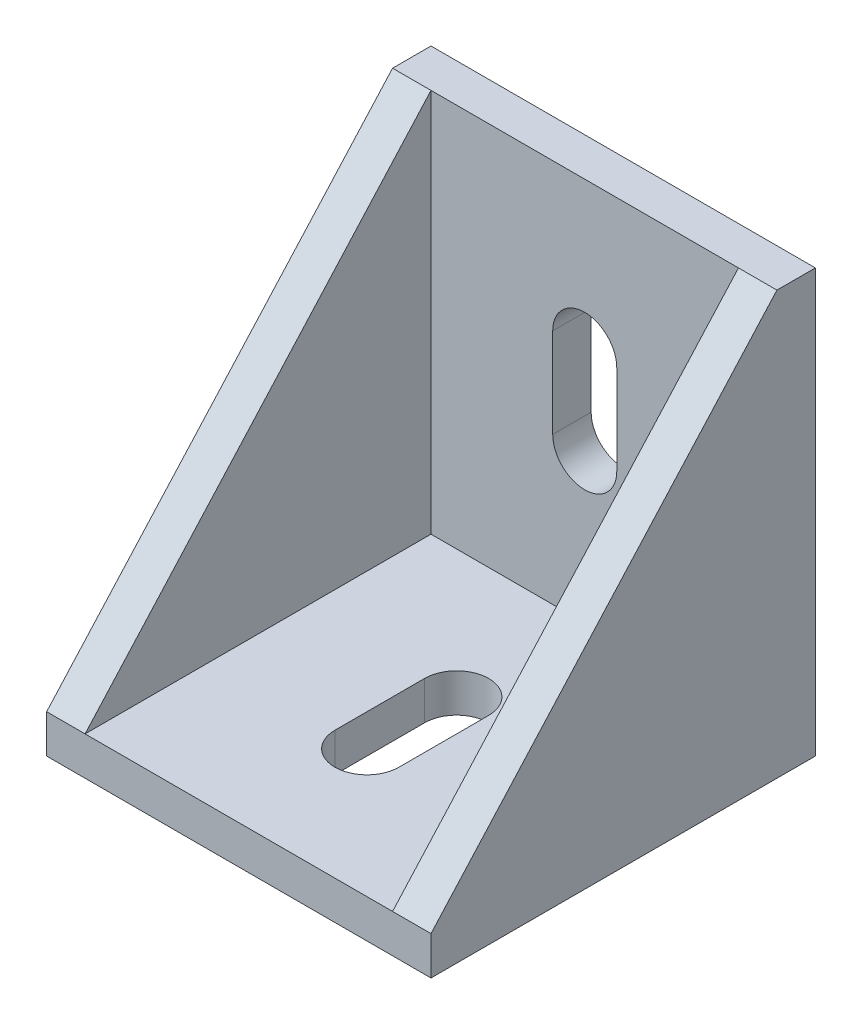
from build123d import *

# Parameters (mm, degrees)
SKETCH1_W           = 30
SKETCH1_H           = 30
BOSS_EXTRUDE1_DEPTH = 3
SKETCH2_W           = 30
SKETCH2_H           = 30
BOSS_EXTRUDE2_DEPTH = 3
BOSS_EXTRUDE3_DEPTH = 3
BOSS_EXTRUDE4_DEPTH = 3
CUT_EXTRUDE1_DEPTH  = 3
CUT_EXTRUDE2_DEPTH  = 3


with BuildPart() as part:
    # Sketch1 → Boss-Extrude1 (new body)
    with BuildSketch(Plane(origin=(0, 0, 0), x_dir=(1, 0, 0), z_dir=(0, 1, 0))):
        with Locations((15, -15)):
            Rectangle(SKETCH1_W, SKETCH1_H)
    extrude(amount=BOSS_EXTRUDE1_DEPTH)

    # Sketch2 → Boss-Extrude2 (add)
    with BuildSketch(Plane(origin=(0, 0, 0), x_dir=(-1, 0, 0), z_dir=(0, 0, -1))):
        with Locations((-15, 18)):
            Rectangle(SKETCH2_W, SKETCH2_H)
    extrude(amount=-BOSS_EXTRUDE2_DEPTH)

    # Sketch3 → Boss-Extrude3 (add)
    with BuildSketch(Plane.ZY):
        Polygon((3, 33), (3, 3), (30, 3), align=None)
    extrude(amount=-BOSS_EXTRUDE3_DEPTH)

    # Sketch4 → Boss-Extrude4 (add)
    with BuildSketch(Plane(origin=(30, 0, 0), x_dir=(0, 0, -1), z_dir=(1, 0, 0))):
        Polygon((-30, 3), (-3, 3), (-3, 33), align=None)
    extrude(amount=-BOSS_EXTRUDE4_DEPTH)

    # Sketch5 → Cut-Extrude1 (cut)
    with BuildSketch(Plane.XY.offset(3)):
        with BuildLine():
            Line((12.5, 14.5), (12.5, 21.5))
            ThreePointArc((12.5, 21.5), (15, 24), (17.5, 21.5))
            Line((17.5, 21.5), (17.5, 14.5))
            ThreePointArc((17.5, 14.5), (15, 12), (12.5, 14.5))
        make_face()
    extrude(amount=-CUT_EXTRUDE1_DEPTH, mode=Mode.SUBTRACT)

    # Sketch6 → Cut-Extrude2 (cut)
    with BuildSketch(Plane(origin=(0, 3, 0), x_dir=(1, 0, 0), z_dir=(0, 1, 0))):
        with BuildLine():
            Line((12.5, -20), (12.5, -13))
            ThreePointArc((12.5, -13), (15, -10.5), (17.5, -13))
            Line((17.5, -13), (17.5, -20))
            ThreePointArc((17.5, -20), (15, -22.5), (12.5, -20))
        make_face()
    extrude(amount=-CUT_EXTRUDE2_DEPTH, mode=Mode.SUBTRACT)


solid = part.part
